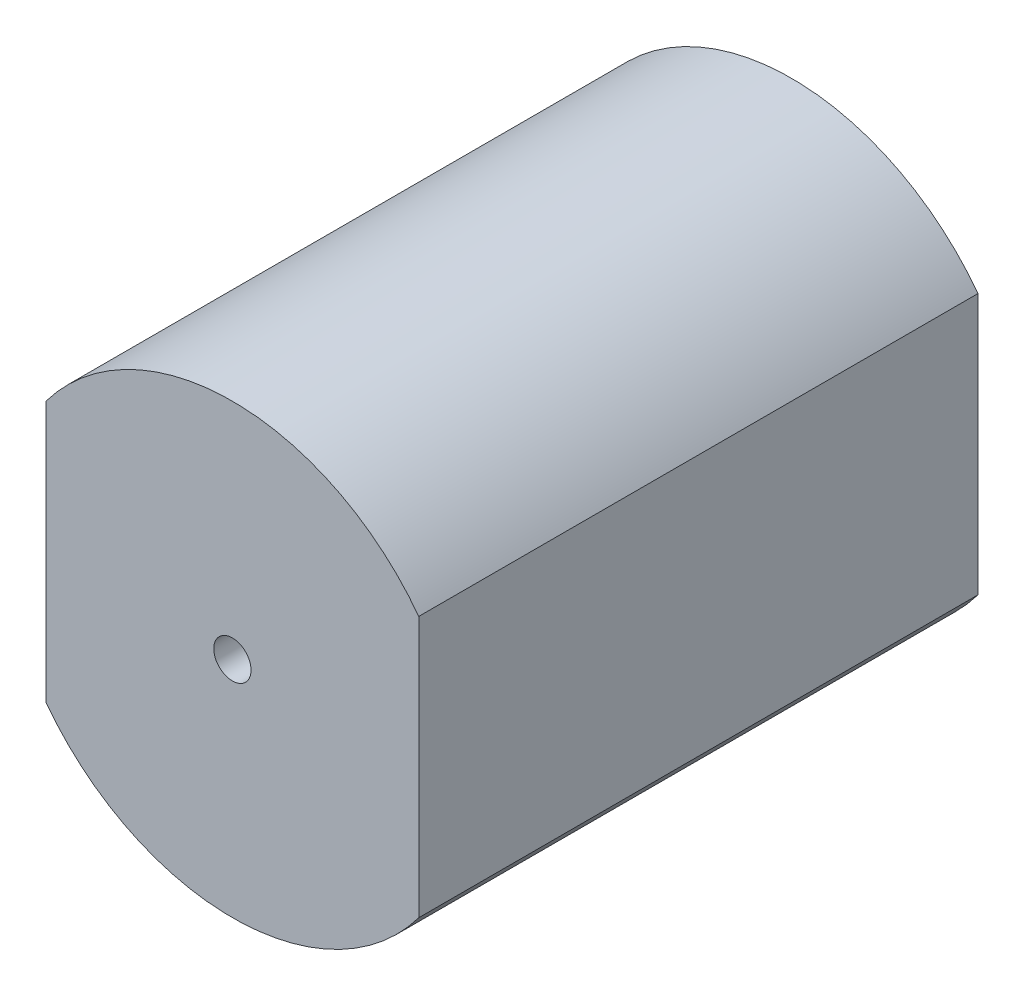
from build123d import *

# Parameters (mm, degrees)
BOSS_EXTRUDE1_DEPTH = 15
SKETCH3_R           = 2.5
BOSS_EXTRUDE2_DEPTH = 2
SKETCH5_R           = 0.5
CUT_EXTRUDE1_DEPTH  = 24.086792761
FILLET1_R           = 0.1


with BuildPart() as part:
    # Sketch1 → Boss-Extrude1 (new body)
    with BuildSketch(Plane.XY):
        with BuildLine():
            Line((0, 2.5), (0, 9.5))
            ThreePointArc((0, 9.5), (5, 12), (10, 9.5))
            Line((10, 9.5), (10, 2.5))
            ThreePointArc((10, 2.5), (5, 0), (0, 2.5))
        make_face()
    extrude(amount=-BOSS_EXTRUDE1_DEPTH)

    # Sketch3 → Boss-Extrude2 (add)
    with BuildSketch(Plane(origin=(0, 0, -15), x_dir=(-1, 0, 0), z_dir=(0, 0, -1))):
        with Locations(Location((-5, 6, 0), (0, 0, 180))):
            Circle(SKETCH3_R)
    extrude(amount=BOSS_EXTRUDE2_DEPTH)

    # Sketch5 → Cut-Extrude1 (cut, through all)
    with BuildSketch(Plane(origin=(0, 0, -17), x_dir=(-1, 0, 0), z_dir=(0, 0, -1))):
        with Locations((-5, 6)):
            Circle(SKETCH5_R)
    extrude(amount=-CUT_EXTRUDE1_DEPTH, mode=Mode.SUBTRACT)

    # Fillet1
    fillet1_edges = [part.edges().sort_by_distance(p)[0] for p in [
        (2.5, 6, -15),
        (2.5, 6, -17),
    ]]
    fillet(fillet1_edges, radius=FILLET1_R)


solid = part.part
